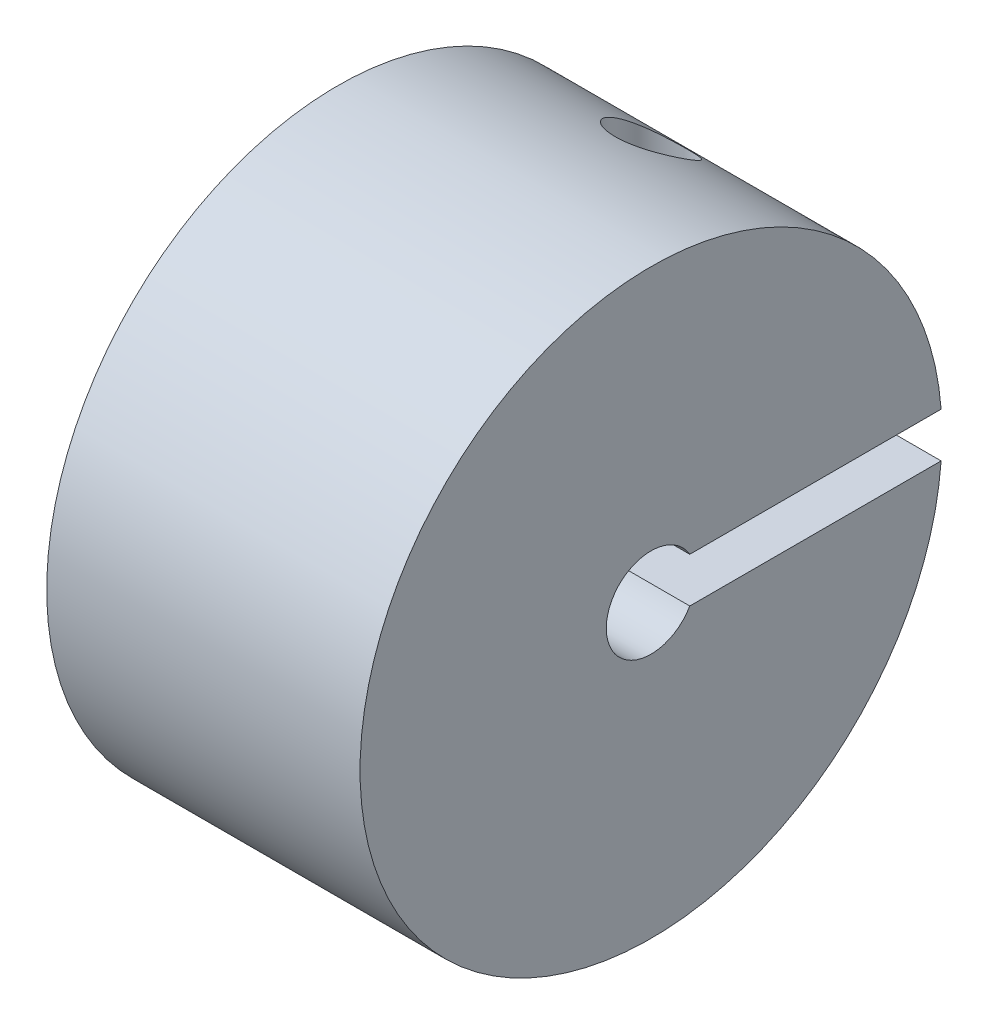
from build123d import *

# Parameters (mm, degrees)
SKETCH1_R           = 6.5
SKETCH1_R_2         = 1
BOSS_EXTRUDE1_DEPTH = 7
SKETCH2_W           = 6.525565823
SKETCH2_H           = 1
CUT_EXTRUDE2_DEPTH  = 12.554220008
SKETCH3_R           = 1.25
CUT_EXTRUDE3_DEPTH  = 12.554220008
CUT_EXTRUDE5_START  = -2
CUT_EXTRUDE5_DEPTH  = 10.554220181
M2_TAPPED_HOLE2_D   = 1.6


with BuildPart() as part:
    # Sketch1 → Boss-Extrude1 (new body)
    with BuildSketch(Plane(origin=(0, 0, 0), x_dir=(0, 0, -1), z_dir=(1, 0, 0))):
        Circle(SKETCH1_R)
        Circle(SKETCH1_R_2, mode=Mode.SUBTRACT)
    extrude(amount=BOSS_EXTRUDE1_DEPTH)

    # Sketch2 → Cut-Extrude2 (cut, through all)
    with BuildSketch(Plane(origin=(0, 0, 0), x_dir=(0, 0, -1), z_dir=(1, 0, 0))):
        with Locations((3.262782911, 0)):
            Rectangle(SKETCH2_W, SKETCH2_H)
    extrude(amount=CUT_EXTRUDE2_DEPTH, mode=Mode.SUBTRACT)

    # Sketch3 → Cut-Extrude3 (cut, through all)
    with BuildSketch(Plane(origin=(0, 0, 0), x_dir=(1, 0, 0), z_dir=(0, 1, 0))):
        with Locations(Location((3.5, 3.5, 0), (0, 0, 270))):
            Circle(SKETCH3_R)
    extrude(amount=-CUT_EXTRUDE3_DEPTH, mode=Mode.SUBTRACT)

    # Sketch4 → Cut-Extrude5 (cut, through all)
    with BuildSketch(Plane(origin=(0, 0, 0), x_dir=(1, 0, 0), z_dir=(0, 1, 0)).offset(CUT_EXTRUDE5_START)):
        with BuildLine():
            Line((1.4, 3.5), (1.4, 9.014179598))
            Line((1.4, 9.014179598), (5.6, 9.014179598))
            Line((5.6, 9.014179598), (5.6, 3.5))
            ThreePointArc((5.6, 3.5), (3.5, 1.4), (1.4, 3.5))
        make_face()
    extrude(amount=-CUT_EXTRUDE5_DEPTH, mode=Mode.SUBTRACT)

    # M2 Tapped Hole2 (through all)
    with Locations(Plane(origin=(0, 0.5, 0), x_dir=(-1, 0, 0), z_dir=(0, -1, 0))):
        with Locations((-3.5, 3.5)):
            Hole(M2_TAPPED_HOLE2_D / 2)


solid = part.part
